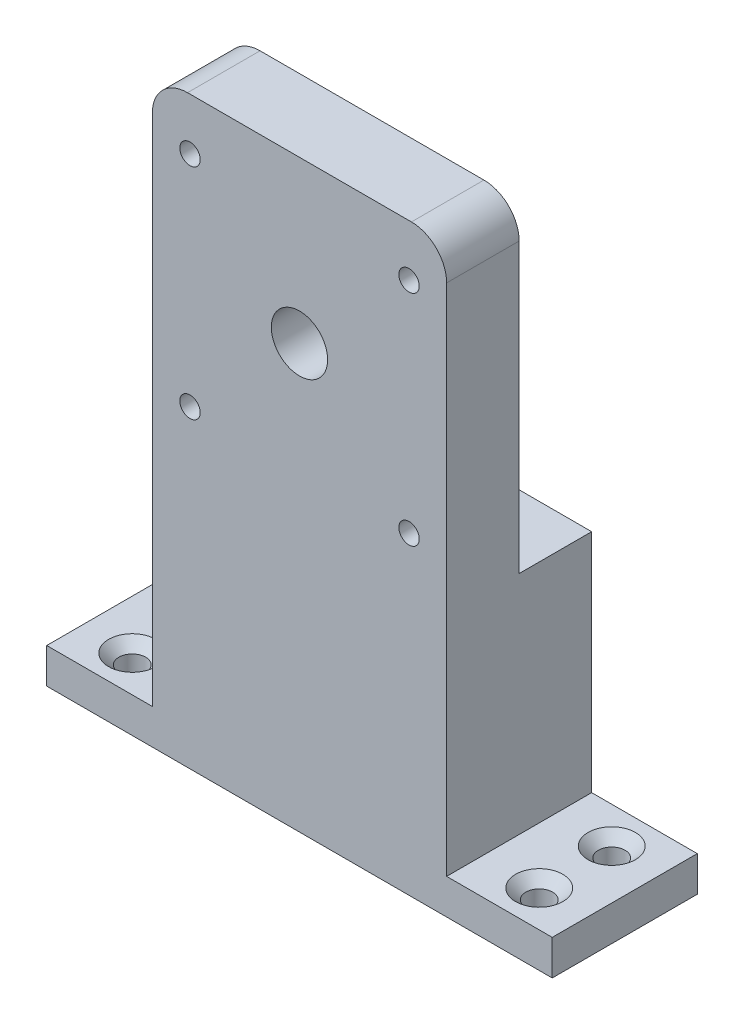
from build123d import *

# Parameters (mm, degrees)
IZIM1_R                                            = 4
IZIM1_R_2                                          = 1.45
Y_KSEKLIK_EKSTR_ZYON1_DEPTH                        = 10.3
IZIM2_R                                            = 1.9
KES_EKSTR_ZYON1_DEPTH                              = 10.3
M3_ALT_GEN_ALYAN_HAV_A_BA_L_K_R_VIDA_I_D           = 3.6
M3_ALT_GEN_ALYAN_HAV_A_BA_L_K_R_VIDA_I_CSINK_D     = 6.72
M3_ALT_GEN_ALYAN_HAV_A_BA_L_K_R_VIDA_I_CSINK_ANGLE = 90
IZIM4_R                                            = 11
KES_EKSTR_ZYON2_DEPTH                              = 2
Y_KSEKLIK_EKSTR_ZYON2_DEPTH                        = 10.3
IZIM6_R                                            = 1.9
KES_EKSTR_ZYON3_DEPTH                              = 10.3
M3_ALT_GEN_ALYAN_HAV_A_BA_L_K_R_VID_2_D            = 3.6
M3_ALT_GEN_ALYAN_HAV_A_BA_L_K_R_VID_2_CSINK_D      = 6.72
M3_ALT_GEN_ALYAN_HAV_A_BA_L_K_R_VID_2_CSINK_ANGLE  = 90


with BuildPart() as part:
    # Çizim1 → Yükseklik-Ekstrüzyon1 (new body)
    with BuildSketch(Plane.XY):
        with BuildLine():
            Line((-35.9, 0), (35.9, 0))
            Line((35.9, 0), (35.9, 5))
            Line((35.9, 5), (20.9, 5))
            Line((20.9, 5), (20.9, 78))
            ThreePointArc((20.9, 78), (19.435533906, 81.535533906), (15.9, 83))
            Line((15.9, 83), (-15.9, 83))
            ThreePointArc((-15.9, 83), (-19.435533906, 81.535533906), (-20.9, 78))
            Line((-20.9, 78), (-20.9, 5))
            Line((-20.9, 5), (-35.9, 5))
            Line((-35.9, 5), (-35.9, 0))
        make_face()
        with Locations(Location((0, 60.1, 0), (0, 0, 180))):
            Circle(IZIM1_R, mode=Mode.SUBTRACT)
        with Locations(Location((-15.55, 75.65, 0), (0, 0, 180))):
            Circle(IZIM1_R_2, mode=Mode.SUBTRACT)
        with Locations(Location((15.56, 75.65, 0), (0, 0, 180))):
            Circle(IZIM1_R_2, mode=Mode.SUBTRACT)
        with Locations(Location((15.56, 44.54, 0), (0, 0, 180))):
            Circle(IZIM1_R_2, mode=Mode.SUBTRACT)
        with Locations(Location((-15.55, 44.54, 0), (0, 0, 180))):
            Circle(IZIM1_R_2, mode=Mode.SUBTRACT)
    extrude(amount=Y_KSEKLIK_EKSTR_ZYON1_DEPTH)

    # Çizim2 → Kes-Ekstrüzyon1 (cut)
    with BuildSketch(Plane(origin=(0, 5, 0), x_dir=(1, 0, 0), z_dir=(0, 1, 0))):
        with Locations(Location((28.9, -5.15, 0), (0, 0, 270))):
            Circle(IZIM2_R)
        with Locations(Location((-28.9, -5.15, 0), (0, 0, 270))):
            Circle(IZIM2_R)
    extrude(amount=-KES_EKSTR_ZYON1_DEPTH, mode=Mode.SUBTRACT)

    # M3 Alt_gen Alyan Hav_a Ba_l_ K_r Vida _i (through all)
    with Locations(Plane(origin=(-28.9, 5, 5.15), x_dir=(0, 0, 1), z_dir=(0, 1, 0))):
        with Locations((0, 0), (0, 57.8)):
            CounterSinkHole(M3_ALT_GEN_ALYAN_HAV_A_BA_L_K_R_VIDA_I_D / 2, M3_ALT_GEN_ALYAN_HAV_A_BA_L_K_R_VIDA_I_CSINK_D / 2, counter_sink_angle=M3_ALT_GEN_ALYAN_HAV_A_BA_L_K_R_VIDA_I_CSINK_ANGLE)

    # Çizim4 → Kes-Ekstrüzyon2 (cut)
    with BuildSketch(Plane(origin=(0, 0, 0), x_dir=(-1, 0, 0), z_dir=(0, 0, -1))):
        with Locations((0, 60.1)):
            Circle(IZIM4_R)
    extrude(amount=-KES_EKSTR_ZYON2_DEPTH, mode=Mode.SUBTRACT)

    # Çizim5 → Yükseklik-Ekstrüzyon2 (add)
    with BuildSketch(Plane(origin=(0, 0, 0), x_dir=(-1, 0, 0), z_dir=(0, 0, -1))):
        Polygon((-20.9, 37.1), (20.9, 37.1), (20.9, 5), (35.9, 5), (35.9, 0), (-35.9, 0), (-35.9, 5), (-20.9, 5), align=None)
    extrude(amount=Y_KSEKLIK_EKSTR_ZYON2_DEPTH)

    # Çizim6 → Kes-Ekstrüzyon3 (cut)
    with BuildSketch(Plane(origin=(0, 5, 0), x_dir=(1, 0, 0), z_dir=(0, 1, 0))):
        with Locations(Location((28.9, 5.15, 0), (0, 0, 270))):
            Circle(IZIM6_R)
        with Locations(Location((-28.9, 5.15, 0), (0, 0, 270))):
            Circle(IZIM6_R)
    extrude(amount=-KES_EKSTR_ZYON3_DEPTH, mode=Mode.SUBTRACT)

    # M3 Alt_gen Alyan Hav_a Ba_l_ K_r Vid 2 (through all)
    with Locations(Plane(origin=(-28.9, 5, -5.15), x_dir=(0, 0, 1), z_dir=(0, 1, 0))):
        with Locations((0, 0), (0, 57.8)):
            CounterSinkHole(M3_ALT_GEN_ALYAN_HAV_A_BA_L_K_R_VID_2_D / 2, M3_ALT_GEN_ALYAN_HAV_A_BA_L_K_R_VID_2_CSINK_D / 2, counter_sink_angle=M3_ALT_GEN_ALYAN_HAV_A_BA_L_K_R_VID_2_CSINK_ANGLE)


solid = part.part
